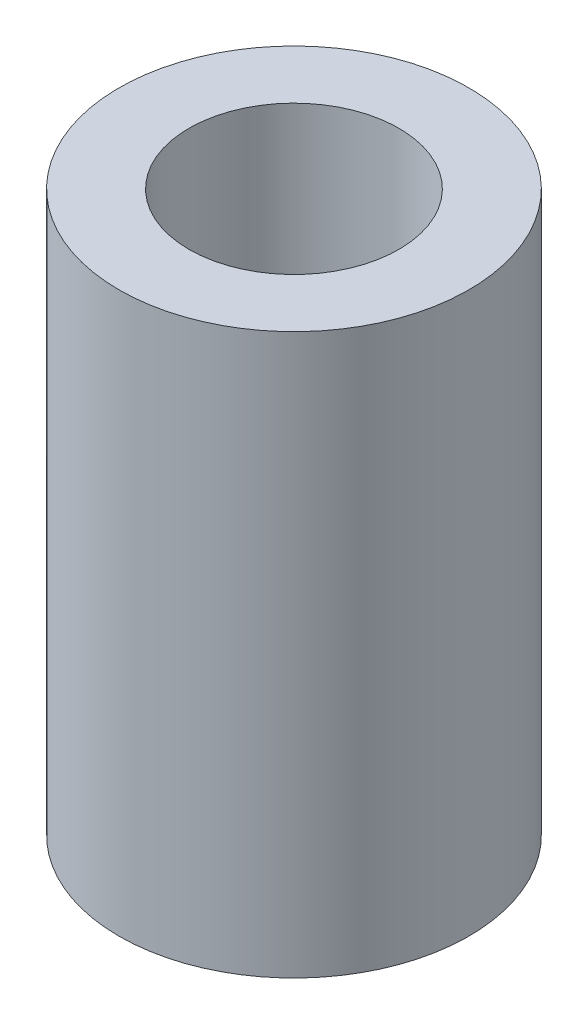
from build123d import *

# Parameters (mm, degrees)
SKETCH_1_R      = 2.5
SKETCH_1_R_2    = 1.5
EXTRUDE_1_DEPTH = 4


with BuildPart() as part:
    # 草图1 → 凸台-拉伸1 (new, symmetric)
    with BuildSketch(Plane(origin=(0, 0, 0), x_dir=(1, 0, 0), z_dir=(0, 1, 0))):
        with Locations(Location((0, 0, 0), (0, 0, 270))):
            Circle(SKETCH_1_R)
        with Locations(Location((0, 0, 0), (0, 0, 270))):
            Circle(SKETCH_1_R_2, mode=Mode.SUBTRACT)
    extrude(amount=EXTRUDE_1_DEPTH, both=True)


solid = part.part
